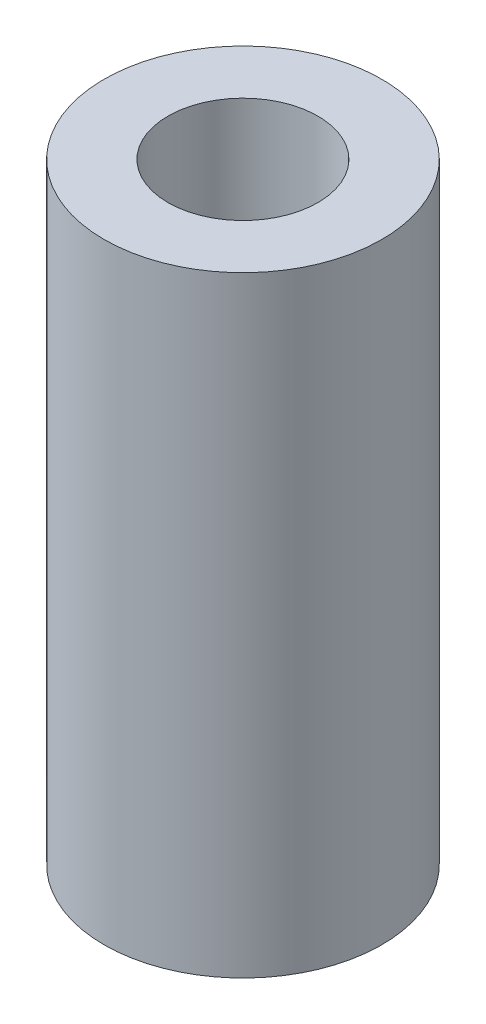
from build123d import *

# Parameters (mm, degrees)
SKETCH_1_R      = 2.5
SKETCH_1_R_2    = 1.35
EXTRUDE_1_DEPTH = 11


with BuildPart() as part:
    # Эскиз1 → Бобышка-Вытянуть1 (new body)
    with BuildSketch(Plane(origin=(0, 0, 0), x_dir=(1, 0, 0), z_dir=(0, 1, 0))):
        with Locations(Location((0, 0, 0), (0, 0, 270))):
            Circle(SKETCH_1_R)
        with Locations(Location((0, 0, 0), (0, 0, 270))):
            Circle(SKETCH_1_R_2, mode=Mode.SUBTRACT)
    extrude(amount=EXTRUDE_1_DEPTH)


solid = part.part
